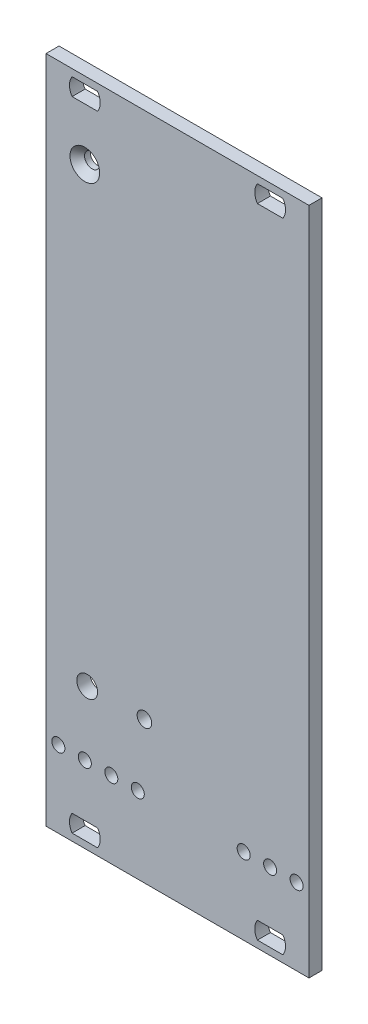
from build123d import *

# Parameters (mm, degrees)
MODEL_W                 = 50.46
MODEL_H                 = 128.4
MODEL_R                 = 1.25
MODEL_R_2               = 1.45
BOSS_EXTRU_1_DEPTH      = 2.5
CHANFREIN1_SIZE         = 1.4
ESQUISSE1_R             = 1.4
ESQUISSE1_R_2           = 2
ENL_V_MAT_EXTRU_1_DEPTH = 138.98196114


with BuildPart() as part:
    # Model → Boss.-Extru.1 (new body)
    with BuildSketch(Plane.XY):
        with Locations((25.23, 64.2)):
            Rectangle(MODEL_W, MODEL_H)
        with Locations((2.37, 14.7)):
            Circle(MODEL_R, mode=Mode.SUBTRACT)
        with Locations((12.53, 14.7)):
            Circle(MODEL_R, mode=Mode.SUBTRACT)
        with Locations(Location((37.93, 14.7, 0), (0, 0, 180))):
            Circle(MODEL_R, mode=Mode.SUBTRACT)
        with Locations((7.45, 14.7)):
            Circle(MODEL_R, mode=Mode.SUBTRACT)
        with Locations((7.45, 113.7)):
            Circle(MODEL_R_2, mode=Mode.SUBTRACT)
        with Locations((17.61, 14.7)):
            Circle(MODEL_R, mode=Mode.SUBTRACT)
        with Locations(Location((43.01, 14.7, 0), (0, 0, 180))):
            Circle(MODEL_R, mode=Mode.SUBTRACT)
        with Locations(Location((48.09, 14.7, 0), (0, 0, 180))):
            Circle(MODEL_R, mode=Mode.SUBTRACT)
        with BuildLine():
            Line((9.895403852, 123.75), (5.004596148, 123.75))
            ThreePointArc((5.004596148, 123.75), (4.5, 125.4), (5.004596148, 127.05))
            Line((5.004596148, 127.05), (9.895403852, 127.05))
            ThreePointArc((9.895403852, 127.05), (10.4, 125.4), (9.895403852, 123.75))
        make_face(mode=Mode.SUBTRACT)
        with BuildLine():
            Line((9.895403852, 1.35), (5.004596148, 1.35))
            ThreePointArc((5.004596148, 1.35), (4.5, 3), (5.004596148, 4.65))
            Line((5.004596148, 4.65), (9.895403852, 4.65))
            ThreePointArc((9.895403852, 4.65), (10.4, 3), (9.895403852, 1.35))
        make_face(mode=Mode.SUBTRACT)
        with BuildLine():
            Line((40.564596148, 1.35), (45.455403852, 1.35))
            ThreePointArc((45.455403852, 1.35), (45.96, 3), (45.455403852, 4.65))
            Line((45.455403852, 4.65), (40.564596148, 4.65))
            ThreePointArc((40.564596148, 4.65), (40.06, 3), (40.564596148, 1.35))
        make_face(mode=Mode.SUBTRACT)
        with BuildLine():
            Line((40.564596148, 123.75), (45.455403852, 123.75))
            ThreePointArc((45.455403852, 123.75), (45.96, 125.4), (45.455403852, 127.05))
            Line((45.455403852, 127.05), (40.564596148, 127.05))
            ThreePointArc((40.564596148, 127.05), (40.06, 125.4), (40.564596148, 123.75))
        make_face(mode=Mode.SUBTRACT)
    extrude(amount=BOSS_EXTRU_1_DEPTH)

    # Chanfrein1
    chanfrein1_edges = [part.edges().sort_by_distance(p)[0] for p in [
        (6, 113.7, 2.5),
    ]]
    chamfer(chanfrein1_edges, length=CHANFREIN1_SIZE)

    # Esquisse1 → Enlèv. mat.-Extru.1 (cut, through all)
    with BuildSketch(Plane.XY.offset(2.5)):
        with Locations((18.887367925, 27.211559267)):
            Circle(ESQUISSE1_R)
        with Locations((7.900573508, 27.200461502)):
            Circle(ESQUISSE1_R_2)
    extrude(amount=-ENL_V_MAT_EXTRU_1_DEPTH, mode=Mode.SUBTRACT)


solid = part.part
